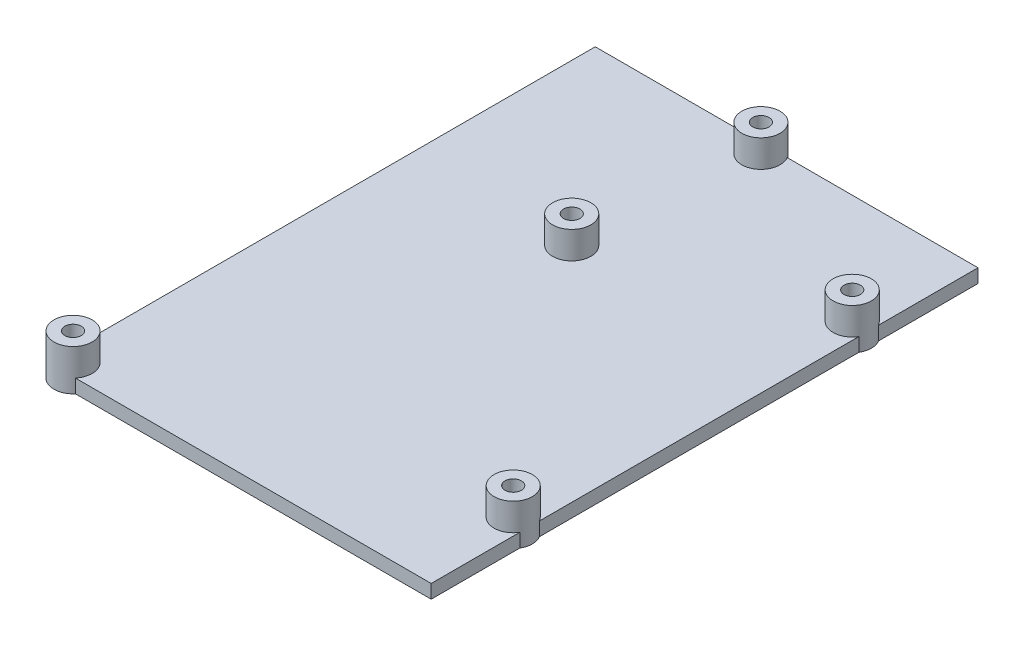
from build123d import *

# Parameters (mm, degrees)
SKETCH2_W                       = 70
SKETCH2_H                       = 100
BOSS_EXTRUDE1_DEPTH             = 2.5
SKETCH3_R                       = 3.5
SKETCH3_R_2                     = 1.5
BOSS_EXTRUDE2_DEPTH             = 5
BOSS_EXTRUDE2_DIRECTION_2_REACH = 150.961


with BuildPart() as part:
    # Sketch2 → Boss-Extrude1 (new body)
    with BuildSketch(Plane(origin=(0, 0, 0), x_dir=(1, 0, 0), z_dir=(0, 1, 0))):
        with Locations((74, 51.5)):
            Rectangle(SKETCH2_W, SKETCH2_H)
    extrude(amount=BOSS_EXTRUDE1_DEPTH)

    # Sketch3 → Boss-Extrude2 (add)
    # profile 1 of 5: a face of its own
    with BuildSketch(Plane(origin=(0, 2.5, 0), x_dir=(1, 0, 0), z_dir=(0, 1, 0))):
        with Locations(Location((41.25, 3.75, 0), (0, 0, 270))):
            Circle(SKETCH3_R)
        with Locations(Location((41.25, 3.75, 0), (0, 0, 270))):
            Circle(SKETCH3_R_2, mode=Mode.SUBTRACT)
    # profile 2 of 5: a face of its own
    with BuildSketch(Plane(origin=(0, 2.5, 0), x_dir=(1, 0, 0), z_dir=(0, 1, 0))):
        with Locations(Location((106, 19.5, 0), (0, 0, 270))):
            Circle(SKETCH3_R)
        with Locations(Location((106, 19.5, 0), (0, 0, 270))):
            Circle(SKETCH3_R_2, mode=Mode.SUBTRACT)
    # profile 3 of 5: a face of its own
    with BuildSketch(Plane(origin=(0, 2.5, 0), x_dir=(1, 0, 0), z_dir=(0, 1, 0))):
        with Locations(Location((106, 81.5, 0), (0, 0, 270))):
            Circle(SKETCH3_R)
        with Locations(Location((106, 81.5, 0), (0, 0, 270))):
            Circle(SKETCH3_R_2, mode=Mode.SUBTRACT)
    # profile 4 of 5: a face of its own
    with BuildSketch(Plane(origin=(0, 2.5, 0), x_dir=(1, 0, 0), z_dir=(0, 1, 0))):
        with Locations(Location((68.3, 67.9, 0), (0, 0, 270))):
            Circle(SKETCH3_R)
        with Locations(Location((68.3, 67.9, 0), (0, 0, 270))):
            Circle(SKETCH3_R_2, mode=Mode.SUBTRACT)
    # profile 5 of 5: a face of its own
    with BuildSketch(Plane(origin=(0, 2.5, 0), x_dir=(1, 0, 0), z_dir=(0, 1, 0))):
        with Locations(Location((71.1, 99.7, 0), (0, 0, 270))):
            Circle(SKETCH3_R)
        with Locations(Location((71.1, 99.7, 0), (0, 0, 270))):
            Circle(SKETCH3_R_2, mode=Mode.SUBTRACT)
    extrude(amount=BOSS_EXTRUDE2_DEPTH)

    # Boss-Extrude2 direction 2: up to this face of the body (flat: up to its plane)
    boss_extrude2_direction_2_end = Plane(part.part.faces().sort_by_distance((74, 0, -51.5))[0])
    # Sketch3 → Boss-Extrude2 direction 2 (add, up to the picked face)
    with BuildSketch(Plane(origin=(0, 2.5, 0), x_dir=(1, 0, 0), z_dir=(0, 1, 0)), mode=Mode.PRIVATE) as boss_extrude2_direction_2_sk1:
        with Locations(Location((41.25, 3.75, 0), (0, 0, 270))):
            Circle(SKETCH3_R)
        with Locations(Location((41.25, 3.75, 0), (0, 0, 270))):
            Circle(SKETCH3_R_2, mode=Mode.SUBTRACT)
    boss_extrude2_direction_2_tool1 = split(extrude(boss_extrude2_direction_2_sk1.sketch, amount=-BOSS_EXTRUDE2_DIRECTION_2_REACH, mode=Mode.PRIVATE), bisect_by=boss_extrude2_direction_2_end, keep=Keep.BOTH, mode=Mode.PRIVATE)
    # Sketch3 → Boss-Extrude2 direction 2 (add, up to the picked face)
    with BuildSketch(Plane(origin=(0, 2.5, 0), x_dir=(1, 0, 0), z_dir=(0, 1, 0)), mode=Mode.PRIVATE) as boss_extrude2_direction_2_sk2:
        with Locations(Location((106, 19.5, 0), (0, 0, 270))):
            Circle(SKETCH3_R)
        with Locations(Location((106, 19.5, 0), (0, 0, 270))):
            Circle(SKETCH3_R_2, mode=Mode.SUBTRACT)
    boss_extrude2_direction_2_tool2 = split(extrude(boss_extrude2_direction_2_sk2.sketch, amount=-BOSS_EXTRUDE2_DIRECTION_2_REACH, mode=Mode.PRIVATE), bisect_by=boss_extrude2_direction_2_end, keep=Keep.BOTH, mode=Mode.PRIVATE)
    # Sketch3 → Boss-Extrude2 direction 2 (add, up to the picked face)
    with BuildSketch(Plane(origin=(0, 2.5, 0), x_dir=(1, 0, 0), z_dir=(0, 1, 0)), mode=Mode.PRIVATE) as boss_extrude2_direction_2_sk3:
        with Locations(Location((106, 81.5, 0), (0, 0, 270))):
            Circle(SKETCH3_R)
        with Locations(Location((106, 81.5, 0), (0, 0, 270))):
            Circle(SKETCH3_R_2, mode=Mode.SUBTRACT)
    boss_extrude2_direction_2_tool3 = split(extrude(boss_extrude2_direction_2_sk3.sketch, amount=-BOSS_EXTRUDE2_DIRECTION_2_REACH, mode=Mode.PRIVATE), bisect_by=boss_extrude2_direction_2_end, keep=Keep.BOTH, mode=Mode.PRIVATE)
    # Sketch3 → Boss-Extrude2 direction 2 (add, up to the picked face)
    with BuildSketch(Plane(origin=(0, 2.5, 0), x_dir=(1, 0, 0), z_dir=(0, 1, 0)), mode=Mode.PRIVATE) as boss_extrude2_direction_2_sk4:
        with Locations(Location((68.3, 67.9, 0), (0, 0, 270))):
            Circle(SKETCH3_R)
        with Locations(Location((68.3, 67.9, 0), (0, 0, 270))):
            Circle(SKETCH3_R_2, mode=Mode.SUBTRACT)
    boss_extrude2_direction_2_tool4 = split(extrude(boss_extrude2_direction_2_sk4.sketch, amount=-BOSS_EXTRUDE2_DIRECTION_2_REACH, mode=Mode.PRIVATE), bisect_by=boss_extrude2_direction_2_end, keep=Keep.BOTH, mode=Mode.PRIVATE)
    # Sketch3 → Boss-Extrude2 direction 2 (add, up to the picked face)
    with BuildSketch(Plane(origin=(0, 2.5, 0), x_dir=(1, 0, 0), z_dir=(0, 1, 0)), mode=Mode.PRIVATE) as boss_extrude2_direction_2_sk5:
        with Locations(Location((71.1, 99.7, 0), (0, 0, 270))):
            Circle(SKETCH3_R)
        with Locations(Location((71.1, 99.7, 0), (0, 0, 270))):
            Circle(SKETCH3_R_2, mode=Mode.SUBTRACT)
    boss_extrude2_direction_2_tool5 = split(extrude(boss_extrude2_direction_2_sk5.sketch, amount=-BOSS_EXTRUDE2_DIRECTION_2_REACH, mode=Mode.PRIVATE), bisect_by=boss_extrude2_direction_2_end, keep=Keep.BOTH, mode=Mode.PRIVATE)
    add(boss_extrude2_direction_2_tool1.solids().sort_by(Axis((41.25, 2.5, -7.151005), (0, -1, 0)))[0])
    add(boss_extrude2_direction_2_tool2.solids().sort_by(Axis((106, 2.5, -22.901005), (0, -1, 0)))[0])
    add(boss_extrude2_direction_2_tool3.solids().sort_by(Axis((106, 2.5, -84.901005), (0, -1, 0)))[0])
    add(boss_extrude2_direction_2_tool4.solids().sort_by(Axis((68.3, 2.5, -71.301005), (0, -1, 0)))[0])
    add(boss_extrude2_direction_2_tool5.solids().sort_by(Axis((71.1, 2.5, -103.101005), (0, -1, 0)))[0])


solid = part.part
